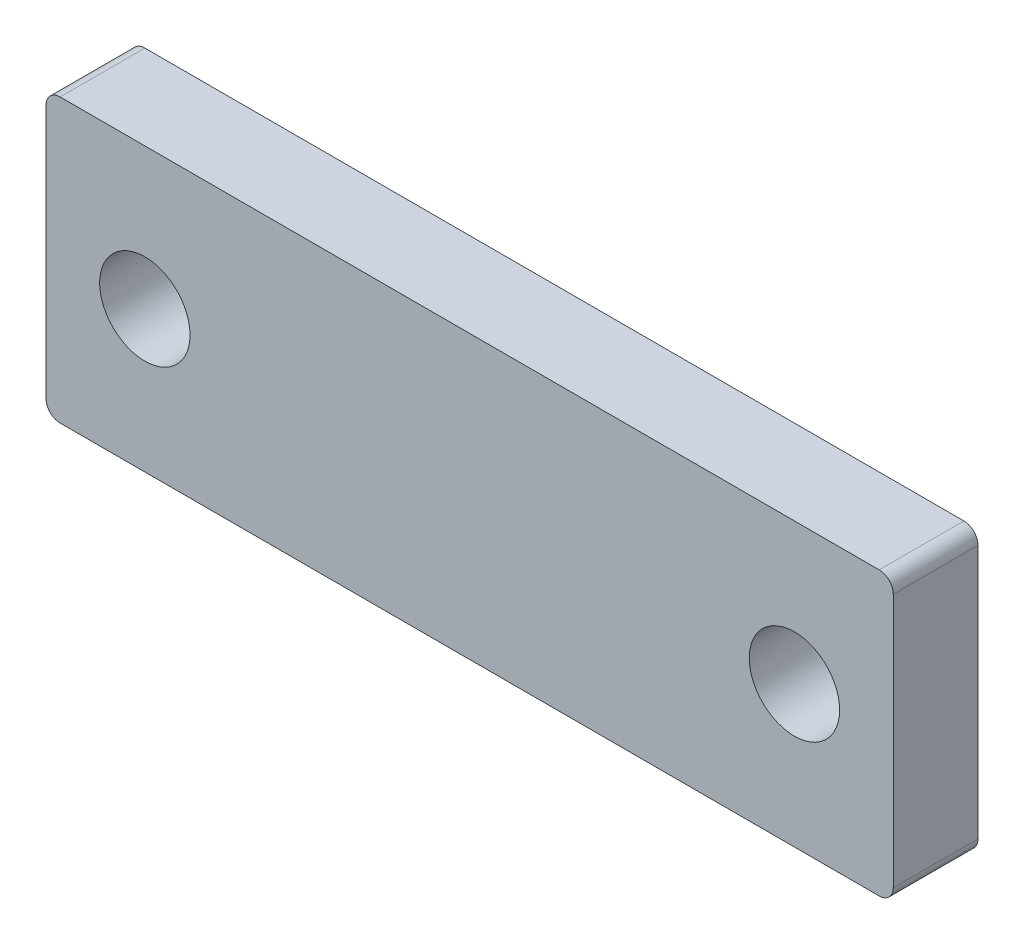
from build123d import *

# Parameters (mm, degrees)
SKETCH1_W            = 30
SKETCH1_H            = 10
BOSS_EXTRUDE1_DEPTH  = 3
M3_CLEARANCE_HOLE1_D = 3.2
FILLET1_R            = 0.5


with BuildPart() as part:
    # Sketch1 → Boss-Extrude1 (new body)
    with BuildSketch(Plane.XY):
        Rectangle(SKETCH1_W, SKETCH1_H)
    extrude(amount=BOSS_EXTRUDE1_DEPTH)

    # M3 Clearance Hole1 (through all)
    with Locations(Plane.XY.offset(3)):
        with Locations((-11.5, 0), (11.5, 0)):
            Hole(M3_CLEARANCE_HOLE1_D / 2)

    # Fillet1
    fillet1_edges = [part.edges().sort_by_distance(p)[0] for p in [
        (-15, 5, 1.5),
        (15, 5, 1.5),
        (15, -5, 1.5),
        (-15, -5, 1.5),
    ]]
    fillet(fillet1_edges, radius=FILLET1_R)


solid = part.part
